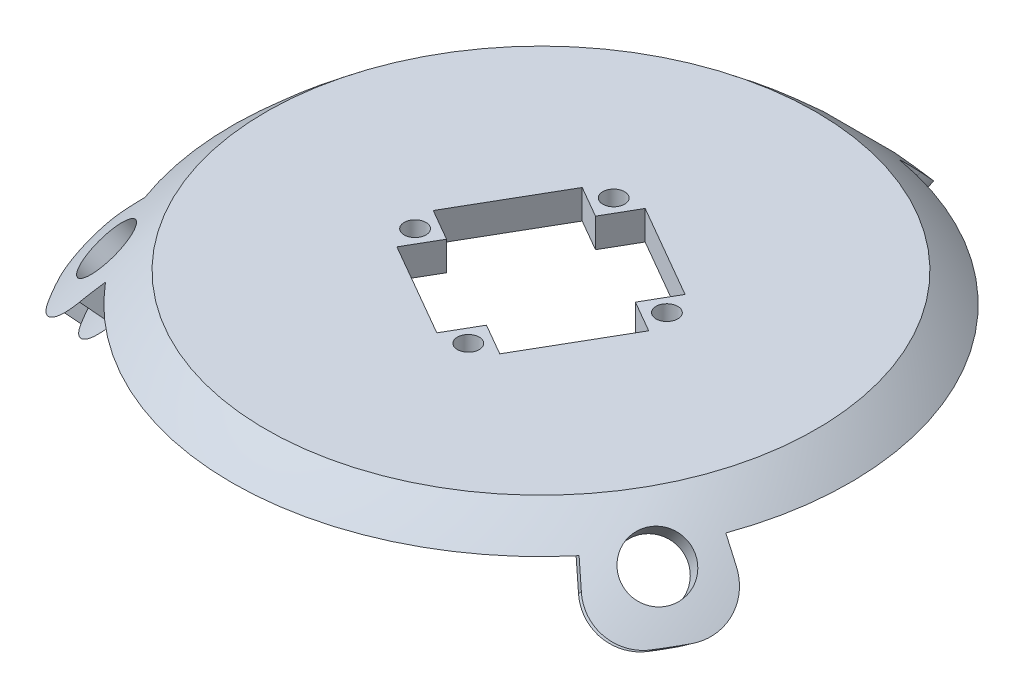
from build123d import *

# Parameters (mm, degrees)
SKETCH_2_R               = 4
CUT_EXTRUDE_1_DEPTH      = 86.073725558
PATTERN_CIRCULAR_1_COUNT = 3
CUT_EXTRUDE_2_DEPTH      = 71.139636296
FILLET_1_R               = 6
CUT_EXTRUDE_3_DEPTH      = 68.666332036
SKETCH_7_R               = 1.5
CUT_EXTRUDE_4_DEPTH      = 10
PATTERN_CIRCULAR_2_COUNT = 4


with BuildPart() as part:
    # 草图1 → 旋转1 (revolve)
    with BuildSketch(Plane.XY):
        with BuildLine():
            Line((37.834997994, 49.117338352), (0, 49.117338352))
            Line((0, 49.117338352), (0, 45.117338352))
            Line((0, 45.117338352), (36.447575777, 45.117338352))
            ThreePointArc((36.447575777, 45.117338352), (41.483889539, 40.535008434), (45.948477813, 35.394030382))
            Line((45.948477813, 35.394030382), (49.117338352, 37.834997994))
            ThreePointArc((49.117338352, 37.834997994), (43.840620434, 43.840620434), (37.834997994, 49.117338352))
        make_face()
    revolve(axis=Axis((0, 0, 0), (0, 1, 0)))

    # 草图2 → 切除-拉伸1 (cut, through all)
    with BuildSketch(Plane(origin=(0, 0, 0), x_dir=(1, 0, 0), z_dir=(0, -0.7071067811865475, 0.7071067811865477))):
        with Locations(Location((0, 0, 0), (0, 0, 270))):
            Circle(SKETCH_2_R)
    cut_extrude_1 = extrude(amount=-CUT_EXTRUDE_1_DEPTH, mode=Mode.SUBTRACT)

    # 阵列(圆周)1: 切除-拉伸1 ×3 about axis
    pattern_circular_1_axis = Axis((0, 49.117338352, 0), (0, -1, 0))
    for i in range(1, PATTERN_CIRCULAR_1_COUNT):
        add(cut_extrude_1.rotate(pattern_circular_1_axis, i * 360 / PATTERN_CIRCULAR_1_COUNT), mode=Mode.SUBTRACT)

    # 草图5 → 切除-拉伸2 (cut, through all)
    with BuildSketch(Plane.XZ.offset(-45.117338352)):
        with BuildLine():
            Line((-41.093147708, 34.481245085), (0, 0))
            Line((0, 0), (41.093147708, 34.481245085))
            ThreePointArc((41.093147708, 34.481245085), (0, 53.643294559), (-41.093147708, 34.481245085))
        make_face()
        with BuildLine():
            Line((50.408208052, 18.347087294), (0, 0))
            Line((0, 0), (9.315060344, -52.828332379))
            ThreePointArc((9.315060344, -52.828332379), (46.456455831, -26.82164728), (50.408208052, 18.347087294))
        make_face()
        with BuildLine():
            Line((-9.315060344, -52.828332379), (0, 0))
            Line((0, 0), (-50.408208052, 18.347087294))
            ThreePointArc((-50.408208052, 18.347087294), (-46.456455831, -26.82164728), (-9.315060344, -52.828332379))
        make_face()
    extrude(amount=CUT_EXTRUDE_2_DEPTH, mode=Mode.SUBTRACT)

    # 圆角1
    fillet_1_edges = [part.edges().sort_by_distance(p)[0] for p in [
        (-36.412320102, 36.614514188, 30.553564368),
        (36.412320102, 36.614514188, 30.553564368),
        (-8.254002868, 36.614514188, -46.810776403),
        (-44.66632297, 36.614514188, 16.257212035),
        (44.66632297, 36.614514188, 16.257212035),
        (8.254002868, 36.614514188, -46.810776403),
    ]]
    fillet(fillet_1_edges, radius=FILLET_1_R)

    # 草图6 → 切除-拉伸3 (cut, through all)
    with BuildSketch(Plane(origin=(0, 49.117338352, 0), x_dir=(1, 0, 0), z_dir=(0, 1, 0))):
        Polygon((14.575317547, 0.245190528), (7.075317547, -12.745190528), (2.745190528, -10.245190528), (0.245190528, -14.575317547), (-12.745190528, -7.075317547), (-10.245190528, -2.745190528), (-14.575317547, -0.245190528), (-7.075317547, 12.745190528), (-2.745190528, 10.245190528), (-0.245190528, 14.575317547), (12.745190528, 7.075317547), (10.245190528, 2.745190528), align=None)
    extrude(amount=-CUT_EXTRUDE_3_DEPTH, mode=Mode.SUBTRACT)

    # 草图7 → 切除-拉伸4 (cut)
    with BuildSketch(Plane(origin=(0, 49.117338352, 0), x_dir=(1, 0, 0), z_dir=(0, 1, 0))):
        with Locations(Location((3.660254038, -13.660254038, 0), (0, 0, 270))):
            Circle(SKETCH_7_R)
    cut_extrude_4 = extrude(amount=-CUT_EXTRUDE_4_DEPTH, mode=Mode.SUBTRACT)

    # 阵列(圆周)2: 切除-拉伸4 ×4 about axis
    pattern_circular_2_axis = Axis((0, 0, 0), (0, 1, 0))
    for i in range(1, PATTERN_CIRCULAR_2_COUNT):
        add(cut_extrude_4.rotate(pattern_circular_2_axis, i * 360 / PATTERN_CIRCULAR_2_COUNT), mode=Mode.SUBTRACT)


solid = part.part
